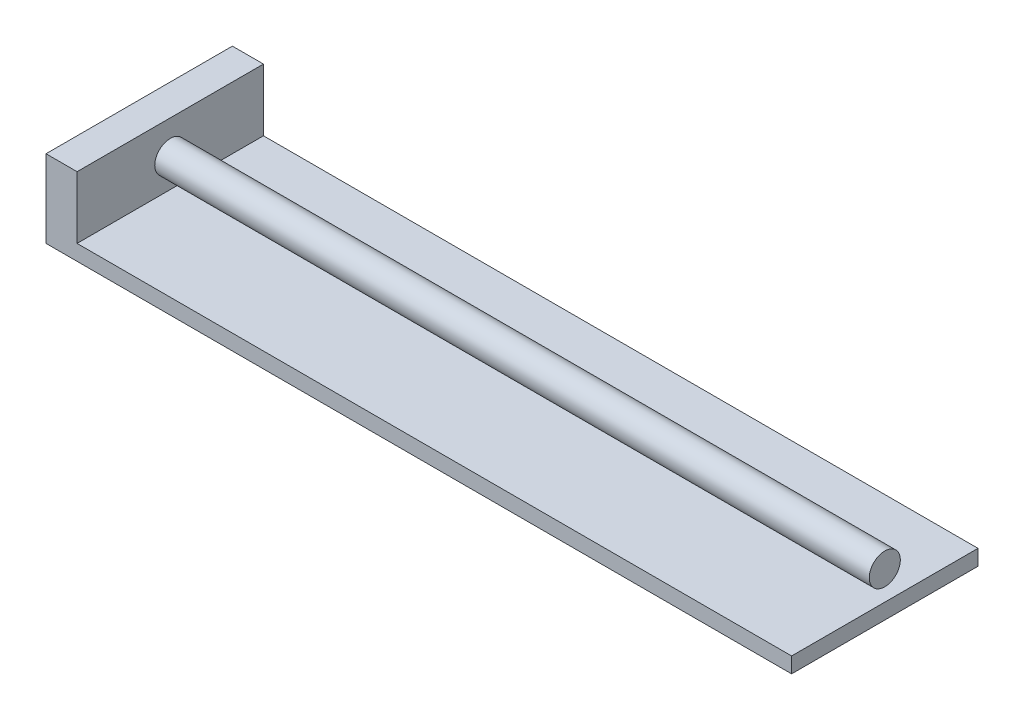
from build123d import *

# Parameters (mm, degrees)
SKETCH1_W           = 240
SKETCH1_H           = 60
BOSS_EXTRUDE1_DEPTH = 5
SKETCH2_W           = 10
SKETCH2_H           = 60
BOSS_EXTRUDE2_DEPTH = 20
SKETCH3_R           = 5
BOSS_EXTRUDE3_DEPTH = 230


with BuildPart() as part:
    # Sketch1 → Boss-Extrude1 (new body)
    with BuildSketch(Plane(origin=(0, 0, 0), x_dir=(1, 0, 0), z_dir=(0, 1, 0))):
        Rectangle(SKETCH1_W, SKETCH1_H)
    extrude(amount=BOSS_EXTRUDE1_DEPTH)

    # Sketch2 → Boss-Extrude2 (add)
    with BuildSketch(Plane(origin=(0, 5, 0), x_dir=(1, 0, 0), z_dir=(0, 1, 0))):
        with Locations((-115, 0)):
            Rectangle(SKETCH2_W, SKETCH2_H)
    extrude(amount=BOSS_EXTRUDE2_DEPTH)

    # Sketch3 → Boss-Extrude3 (add, through all)
    with BuildSketch(Plane(origin=(-110, 0, 0), x_dir=(0, 0, -1), z_dir=(1, 0, 0))):
        with Locations(Location((0, 14.27, 0), (0, 0, 180))):
            Circle(SKETCH3_R)
    extrude(amount=BOSS_EXTRUDE3_DEPTH)


solid = part.part
